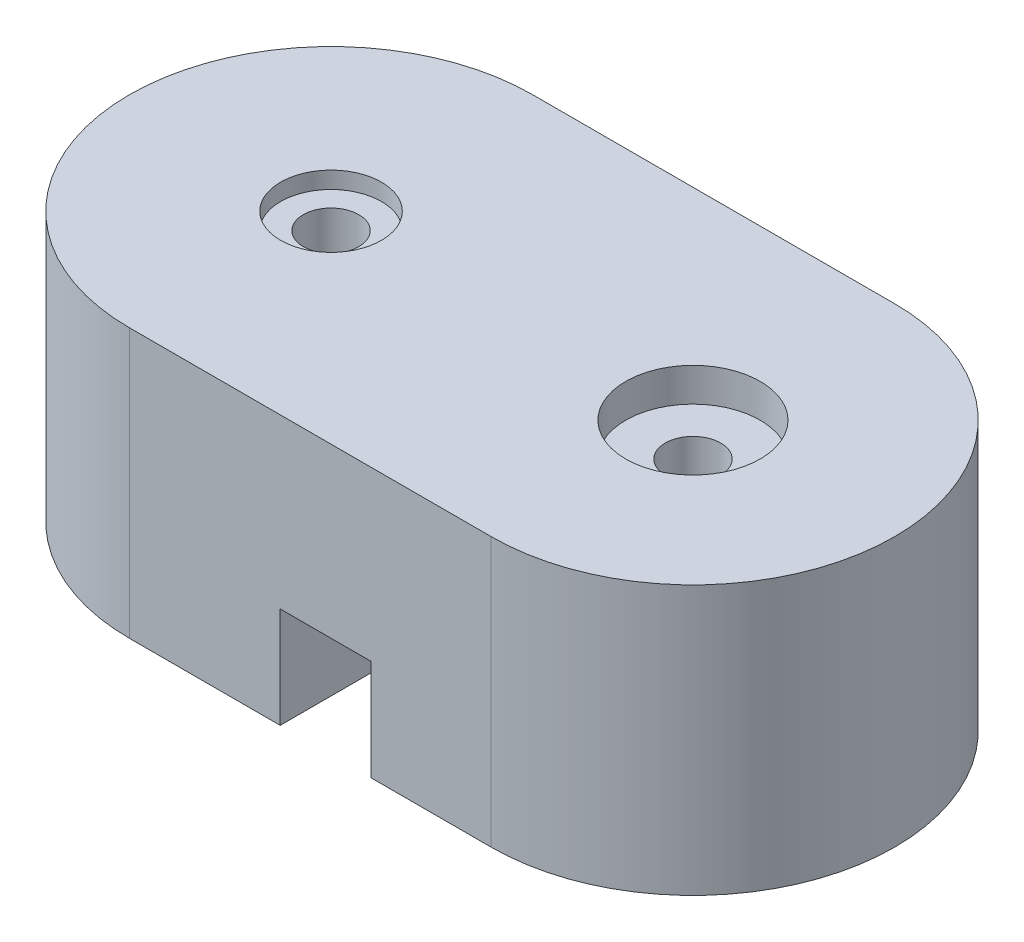
from build123d import *
from build123d.topology import SkipClean

# Parameters (mm, degrees)
EXTRUDE_1_DEPTH     = 13
CUT_EXTRUDE_1_DEPTH = 3
SKETCH_3_R          = 4
CUT_EXTRUDE_2_DEPTH = 2
SKETCH_4_R          = 1.65
CUT_EXTRUDE_3_DEPTH = 28.98651863
SKETCH_5_R          = 3
CUT_EXTRUDE_4_DEPTH = 1
SKETCH_6_R          = 1.65
CUT_EXTRUDE_5_DEPTH = 29.394457646
SKETCH_7_R          = 7.5
CUT_EXTRUDE_6_DEPTH = 6.3
SKETCH_8_R          = 5
CUT_EXTRUDE_7_DEPTH = 8.3
EXTRUDE_START       = 3
SKETCH_9_R          = 5
EXTRUDE_3_DEPTH     = 3


with BuildPart() as part:
    # 草图1 → 凸台-拉伸1 (new body)
    with BuildSketch(Plane(origin=(0, 0, 0), x_dir=(1, 0, 0), z_dir=(0, 1, 0))):
        with BuildLine():
            Line((-10.765, 12), (10.765, 12))
            ThreePointArc((10.765, 12), (22.765, 0), (10.765, -12))
            Line((10.765, -12), (-10.765, -12))
            ThreePointArc((-10.765, -12), (-22.765, 0), (-10.765, 12))
        make_face()
    extrude(amount=EXTRUDE_1_DEPTH)

    # 草图2 → 切除-拉伸1 (cut)
    with BuildSketch(Plane.XZ):
        Polygon((0, 12), (-1.79, 12), (-1.79, -12), (3.6, -12), (3.6, 12), align=None)
    extrude(amount=-CUT_EXTRUDE_1_DEPTH, mode=Mode.SUBTRACT)

    # 草图3 → 切除-拉伸2 (cut)
    with BuildSketch(Plane(origin=(0, 13, 0), x_dir=(1, 0, 0), z_dir=(0, 1, 0))):
        with Locations(Location((10.765, 0, 0), (0, 0, 270))):
            Circle(SKETCH_3_R)
    extrude(amount=-CUT_EXTRUDE_2_DEPTH, mode=Mode.SUBTRACT)

    # 草图4 → 切除-拉伸3 (cut, through all)
    with BuildSketch(Plane(origin=(0, 11, 0), x_dir=(1, 0, 0), z_dir=(0, 1, 0))):
        with Locations(Location((10.765, 0, 0), (0, 0, 270))):
            Circle(SKETCH_4_R)
    extrude(amount=-CUT_EXTRUDE_3_DEPTH, mode=Mode.SUBTRACT)

    # 草图5 → 切除-拉伸4 (cut)
    with BuildSketch(Plane(origin=(0, 13, 0), x_dir=(1, 0, 0), z_dir=(0, 1, 0))):
        with Locations(Location((-10.765, 0, 0), (0, 0, 270))):
            Circle(SKETCH_5_R)
    extrude(amount=-CUT_EXTRUDE_4_DEPTH, mode=Mode.SUBTRACT)

    # 草图6 → 切除-拉伸5 (cut, through all)
    with BuildSketch(Plane(origin=(0, 12, 0), x_dir=(1, 0, 0), z_dir=(0, 1, 0))):
        with Locations(Location((-10.765, 0, 0), (0, 0, 270))):
            Circle(SKETCH_6_R)
    extrude(amount=-CUT_EXTRUDE_5_DEPTH, mode=Mode.SUBTRACT)

    # 草图7 → 切除-拉伸6 (cut)
    with BuildSketch(Plane.XZ):
        with Locations(Location((10.765, 0, 0), (0, 0, 270))):
            Circle(SKETCH_7_R)
    extrude(amount=-CUT_EXTRUDE_6_DEPTH, mode=Mode.SUBTRACT)

    # 草图8 → 切除-拉伸7 (cut)
    with BuildSketch(Plane.XZ):
        with Locations(Location((-10.765, 0, 0), (0, 0, 270))):
            Circle(SKETCH_8_R)
    extrude(amount=-CUT_EXTRUDE_7_DEPTH, mode=Mode.SUBTRACT)

    # 草图9 → 凸台-拉伸3 (add)
    # profile 1 of 2: a face of its own
    with SkipClean():  # the faces are left unmerged after this step: merging them gives an invalid solid
        with BuildSketch(Plane.XZ.offset(EXTRUDE_START)):
            with BuildLine():
                Line((-10.765, -12), (-1.79, -12))
                Line((-1.79, -12), (-1.79, 12))
                Line((-1.79, 12), (-10.765, 12))
                ThreePointArc((-10.765, 12), (-22.765, 0), (-10.765, -12))
            make_face()
            with Locations(Location((-10.765, 0, 0), (0, 0, 270))):
                Circle(SKETCH_9_R, mode=Mode.SUBTRACT)
        # profile 2 of 2: a face of its own
        with BuildSketch(Plane.XZ.offset(EXTRUDE_START)):
            with BuildLine():
                Line((3.6, 12), (3.6, 2.216478062))
                ThreePointArc((3.6, 2.216478062), (18.265, 0), (3.6, -2.216478062))
                Line((3.6, -2.216478062), (3.6, -12))
                Line((3.6, -12), (10.765, -12))
                ThreePointArc((10.765, -12), (22.765, 0), (10.765, 12))
                Line((10.765, 12), (3.6, 12))
            make_face()
        extrude(amount=-EXTRUDE_3_DEPTH)


solid = part.part
